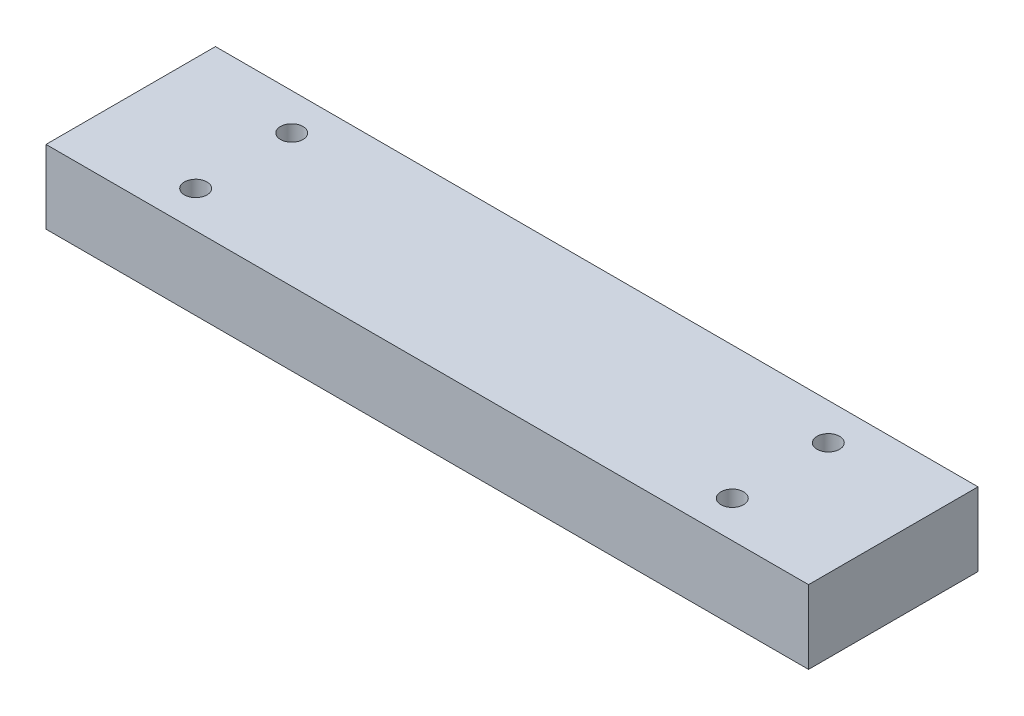
from build123d import *

# Parameters (mm, degrees)
SKETCH1_W           = 135
SKETCH1_H           = 30
BOSS_EXTRUDE1_DEPTH = 13
SKETCH2_R           = 2
CUT_EXTRUDE1_DEPTH  = 35


with BuildPart() as part:
    # Sketch1 → Boss-Extrude1 (new body)
    with BuildSketch(Plane(origin=(0, 0, 0), x_dir=(1, 0, 0), z_dir=(0, 1, 0))):
        with Locations((67.5, 15)):
            Rectangle(SKETCH1_W, SKETCH1_H)
    extrude(amount=BOSS_EXTRUDE1_DEPTH)

    # Sketch2 → Cut-Extrude1 (cut)
    with BuildSketch(Plane(origin=(0, 13, 0), x_dir=(1, 0, 0), z_dir=(0, 1, 0))):
        with Locations(Location((20, 23.5, 0), (0, 0, 270))):
            Circle(SKETCH2_R)
        with Locations(Location((20, 6.5, 0), (0, 0, 270))):
            Circle(SKETCH2_R)
        with Locations(Location((115, 23.5, 0), (0, 0, 270))):
            Circle(SKETCH2_R)
        with Locations(Location((115, 6.5, 0), (0, 0, 270))):
            Circle(SKETCH2_R)
    extrude(amount=-CUT_EXTRUDE1_DEPTH, mode=Mode.SUBTRACT)


solid = part.part
